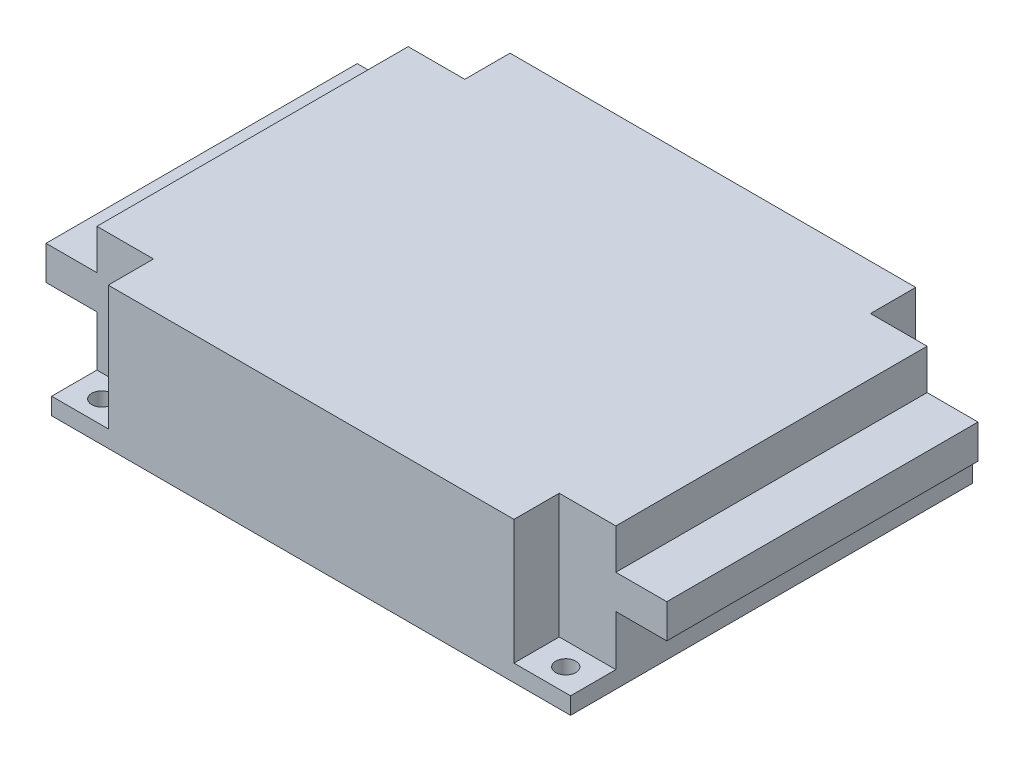
from build123d import *

# Parameters (mm, degrees)
SKETCH_2_W        = 10.00292335
SKETCH_2_H        = 8.000270383
SKETCH_2_R        = 1.765598383
EXTRUDE_2_DEPTH   = 3
EXTRUDE_2_2_DEPTH = 3
EXTRUDE_2_3_DEPTH = 3
EXTRUDE_2_4_DEPTH = 3
EXTRUDE_3_DEPTH   = 25
SKETCH_3_W        = 54.999459234
SKETCH_3_H        = 6
EXTRUDE_4_DEPTH   = 9
SKETCH_5_W        = 54.999459234
SKETCH_5_H        = 6
EXTRUDE_6_DEPTH   = 9


with BuildPart() as part:
    # 草图2 → 凸台-拉伸2 (new body)
    with BuildSketch(Plane(origin=(0, 0, 0), x_dir=(1, 0, 0), z_dir=(0, 1, 0))):
        with Locations((5.001461675, 55.999864809)):
            Rectangle(SKETCH_2_W, SKETCH_2_H)
        with Locations((4.853675934, 55.999601401)):
            Circle(SKETCH_2_R, mode=Mode.SUBTRACT)
    extrude(amount=EXTRUDE_2_DEPTH)



with BuildPart() as body_2:
    # 草图2 → Extrude 2 2 (new body)
    with BuildSketch(Plane(origin=(0, 0, 0), x_dir=(1, 0, 0), z_dir=(0, 1, 0))):
        with Locations((86.698538325, 55.999864809)):
            Rectangle(SKETCH_2_W, SKETCH_2_H)
        with Locations((86.846324066, 55.999601401)):
            Circle(SKETCH_2_R, mode=Mode.SUBTRACT)
    extrude(amount=EXTRUDE_2_2_DEPTH)


with BuildPart() as body_3:
    # 草图2 → Extrude 2 3 (new body)
    with BuildSketch(Plane(origin=(0, 0, 0), x_dir=(1, 0, 0), z_dir=(0, 1, 0))):
        with Locations((5.001461675, -6.999864808)):
            Rectangle(SKETCH_2_W, SKETCH_2_H)
        with Locations((4.853675934, -6.999601401)):
            Circle(SKETCH_2_R, mode=Mode.SUBTRACT)
    extrude(amount=EXTRUDE_2_3_DEPTH)


with BuildPart() as body_4:
    # 草图2 → Extrude 2 4 (new body)
    with BuildSketch(Plane(origin=(0, 0, 0), x_dir=(1, 0, 0), z_dir=(0, 1, 0))):
        with Locations((86.698538325, -6.999864808)):
            Rectangle(SKETCH_2_W, SKETCH_2_H)
        with Locations((86.846324066, -6.999601401)):
            Circle(SKETCH_2_R, mode=Mode.SUBTRACT)
    extrude(amount=EXTRUDE_2_4_DEPTH)


with BuildPart() as part_1:
    add(part.part)

    add(body_2.part)  # 凸台-拉伸3 merges body 2

    add(body_3.part)  # 凸台-拉伸3 merges body 3

    add(body_4.part)  # 凸台-拉伸3 merges body 4
    # 草图2<7> → 凸台-拉伸3 (add)
    with BuildSketch(Plane(origin=(0, 0, 0), x_dir=(1, 0, 0), z_dir=(0, 1, 0))):
        Polygon((81.69707665, 60), (10.00292335, 60), (10.00292335, 51.999729617), (0, 51.999729617), (0, 49), (0, 0), (0, -2.999729617), (10.00292335, -2.999729617), (10.00292335, -11), (81.69707665, -11), (81.69707665, -2.999729617), (91.7, -2.999729617), (91.7, 0), (91.7, 49), (91.7, 51.999729617), (81.69707665, 51.999729617), align=None)
    extrude(amount=EXTRUDE_3_DEPTH)

    # 草图3 → 凸台-拉伸4 (add)
    with BuildSketch(Plane(origin=(0, 0, 0), x_dir=(0, 0, -1), z_dir=(1, 0, 0))):
        with Locations((24.5, 14.9)):
            Rectangle(SKETCH_3_W, SKETCH_3_H)
    extrude(amount=-EXTRUDE_4_DEPTH)

    # 草图5 → 凸台-拉伸6 (add)
    with BuildSketch(Plane(origin=(91.7, 0, 0), x_dir=(0, 0, -1), z_dir=(1, 0, 0))):
        with Locations((24.5, 14.9)):
            Rectangle(SKETCH_5_W, SKETCH_5_H)
    extrude(amount=EXTRUDE_6_DEPTH)


solid = part_1.part
